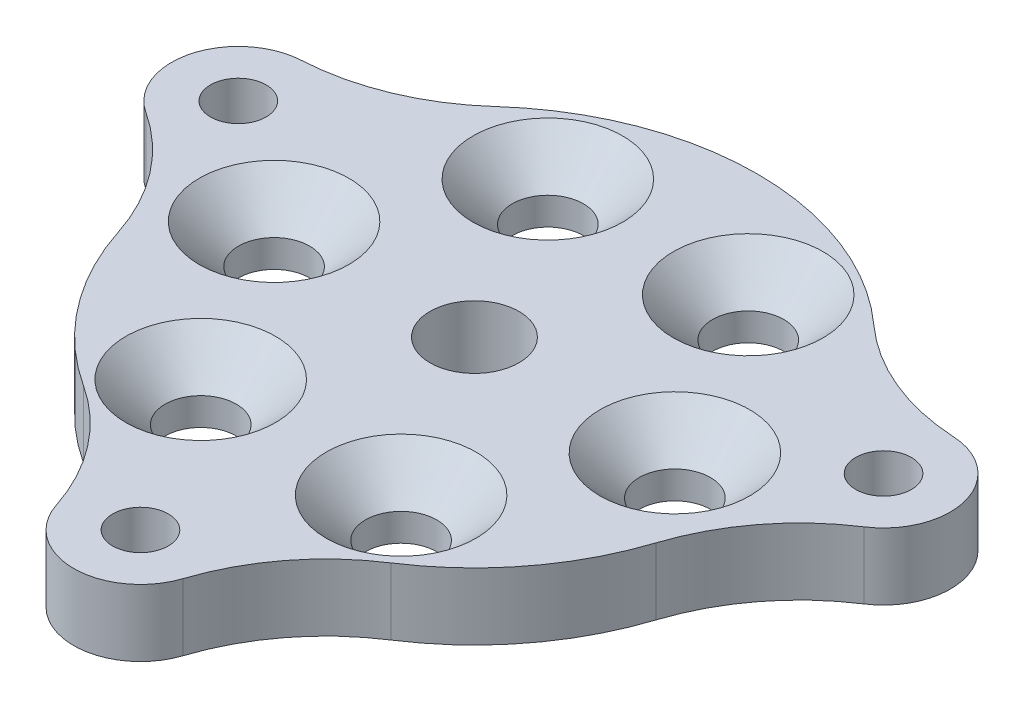
from build123d import *

# Parameters (mm, degrees)
SKETCH1_R                    = 12.7
SKETCH1_R_2                  = 2
BOSS_EXTRUDE1_DEPTH          = 3
CSK_FOR_M3_SFHCS1_AT_2_COUNT = 2
CSK_FOR_M3_SFHCS1_AT_2_PITCH = 9
CSK_FOR_M3_SFHCS1_AT_3_COUNT = 2
CSK_FOR_M3_SFHCS1_AT_3_PITCH = 15.588457268
CSK_FOR_M3_SFHCS1_AT_4_COUNT = 2
CSK_FOR_M3_SFHCS1_AT_4_PITCH = 18
CSK_FOR_M3_SFHCS1_AT_5_COUNT = 2
CSK_FOR_M3_SFHCS1_AT_5_PITCH = 15.588457268
CSK_FOR_M3_SFHCS1_AT_6_COUNT = 2
CSK_FOR_M3_SFHCS1_AT_6_PITCH = 9
SKETCH6_R                    = 3
BOSS_EXTRUDE2_DEPTH          = 3
FILLET1_R                    = 10
TAP_DRILL_FOR_M3X0_5_TAP1_D  = 2.5


with BuildPart() as part:
    # Sketch1 → Boss-Extrude1 (new body)
    with BuildSketch(Plane(origin=(0, 0, 0), x_dir=(1, 0, 0), z_dir=(0, 1, 0))):
        with Locations(Location((0, 0, 0), (0, 0, 270))):
            Circle(SKETCH1_R)
        with Locations(Location((0, 0, 0), (0, 0, 270))):
            Circle(SKETCH1_R_2, mode=Mode.SUBTRACT)
    extrude(amount=BOSS_EXTRUDE1_DEPTH)

    # Sketch3 → CSK for M3 SFHCS1 (revolve, cut)
    with BuildSketch(Plane(origin=(-9, 3, 0), x_dir=(0, 0, 1), z_dir=(1, 0, 0))):
        Polygon((0, 0), (0, 3), (1.6, 3), (1.6, 1.76), (3.36, 0), align=None)
    csk_for_m3_sfhcs1 = revolve(axis=Axis((-9, 9.35, 0), (0, -1, 0)), mode=Mode.SUBTRACT)

    # CSK for M3 SFHCS1 at 2: CSK for M3 SFHCS1 ×2
    with Locations(*[Vector(0.5000000000000003, 0, -0.8660254037844386) * (i * CSK_FOR_M3_SFHCS1_AT_2_PITCH) for i in range(1, CSK_FOR_M3_SFHCS1_AT_2_COUNT)]):
        add(csk_for_m3_sfhcs1, mode=Mode.SUBTRACT)

    # CSK for M3 SFHCS1 at 3: CSK for M3 SFHCS1 ×2
    with Locations(*[Vector(0.8660254037844387, 0, -0.4999999999999999) * (i * CSK_FOR_M3_SFHCS1_AT_3_PITCH) for i in range(1, CSK_FOR_M3_SFHCS1_AT_3_COUNT)]):
        add(csk_for_m3_sfhcs1, mode=Mode.SUBTRACT)

    # CSK for M3 SFHCS1 at 4: CSK for M3 SFHCS1 ×2
    with Locations(*[(i * CSK_FOR_M3_SFHCS1_AT_4_PITCH, 0, 0) for i in range(1, CSK_FOR_M3_SFHCS1_AT_4_COUNT)]):
        add(csk_for_m3_sfhcs1, mode=Mode.SUBTRACT)

    # CSK for M3 SFHCS1 at 5: CSK for M3 SFHCS1 ×2
    with Locations(*[Vector(0.8660254037844387, 0, 0.49999999999999994) * (i * CSK_FOR_M3_SFHCS1_AT_5_PITCH) for i in range(1, CSK_FOR_M3_SFHCS1_AT_5_COUNT)]):
        add(csk_for_m3_sfhcs1, mode=Mode.SUBTRACT)

    # CSK for M3 SFHCS1 at 6: CSK for M3 SFHCS1 ×2
    with Locations(*[Vector(0.5000000000000002, 0, 0.8660254037844386) * (i * CSK_FOR_M3_SFHCS1_AT_6_PITCH) for i in range(1, CSK_FOR_M3_SFHCS1_AT_6_COUNT)]):
        add(csk_for_m3_sfhcs1, mode=Mode.SUBTRACT)

    # Sketch6 → Boss-Extrude2 (add)
    with BuildSketch(Plane(origin=(0, 3, 0), x_dir=(1, 0, 0), z_dir=(0, 1, 0))):
        with Locations((14.488887394, 3.882285677)):
            Circle(SKETCH6_R)
        with Locations((0, -15)):
            Circle(SKETCH6_R)
        with Locations((-14.488887394, 3.882285677)):
            Circle(SKETCH6_R)
    extrude(amount=-BOSS_EXTRUDE2_DEPTH)

    # Fillet1
    fillet1_edges = [part.edges().sort_by_distance(p)[0] for p in [
        (11.690211932, 1.5, -4.962755785),
        (12.605398401, 1.5, -1.547233383),
        (1.768004493, 1.5, 12.576333333),
        (-1.768004493, 1.5, 12.576333333),
        (-11.690211932, 1.5, -4.962755785),
        (-12.605398401, 1.5, -1.547233383),
    ]]
    fillet(fillet1_edges, radius=FILLET1_R)

    # Tap Drill for M3x0.5 Tap1 (through all)
    with Locations(Plane(origin=(0, 3, 0), x_dir=(1, 0, 0), z_dir=(0, 1, 0))):
        with Locations((-14.488887394, 3.882285677), (14.488887394, 3.882285677), (0, -15)):
            Hole(TAP_DRILL_FOR_M3X0_5_TAP1_D / 2)


solid = part.part
